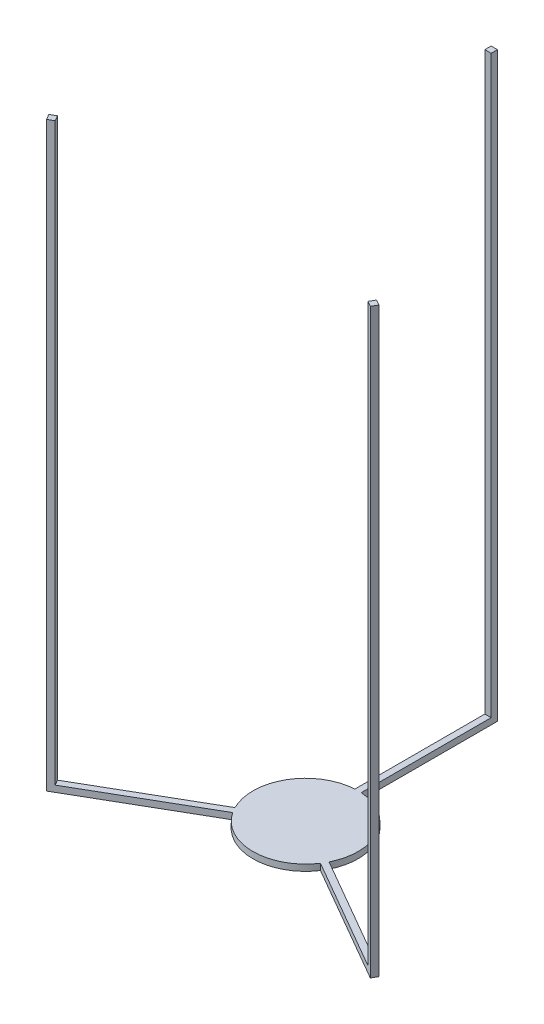
from build123d import *

# Parameters (mm, degrees)
ESQUISSE2_W                  = 6
ESQUISSE2_H                  = 6
ESQUISSE3_R                  = 50
BOSS_EXTRU_1_DEPTH           = 3
R_P_TITION_CIRCULAIRE1_COUNT = 3


with BuildPart() as part:
    # Balayage2: sweep along a curve in space
    with BuildLine() as balayage2_path:
        Line((0, 0, 0), (0, 0, -176.45))
        Line((0, 0, -176.45), (0, 550, -176.45))
    # Esquisse2 → Balayage2 (sweep)
    with BuildSketch(Plane.XY):
        Rectangle(ESQUISSE2_W, ESQUISSE2_H)
    balayage2 = sweep(path=balayage2_path.line, transition=Transition.RIGHT)

    # Esquisse3 → Boss.-Extru.1 (add, symmetric)
    with BuildSketch(Plane(origin=(0, 0, 0), x_dir=(1, 0, 0), z_dir=(0, 1, 0))):
        Circle(ESQUISSE3_R)
    extrude(amount=BOSS_EXTRU_1_DEPTH, both=True)

    # Répétition circulaire1: Balayage2 ×3 about axis
    r_p_tition_circulaire1_axis = Axis((0, 0, 0), (0, 1, 0))
    for i in range(1, R_P_TITION_CIRCULAIRE1_COUNT):
        add(balayage2.rotate(r_p_tition_circulaire1_axis, i * 360 / R_P_TITION_CIRCULAIRE1_COUNT))


solid = part.part
